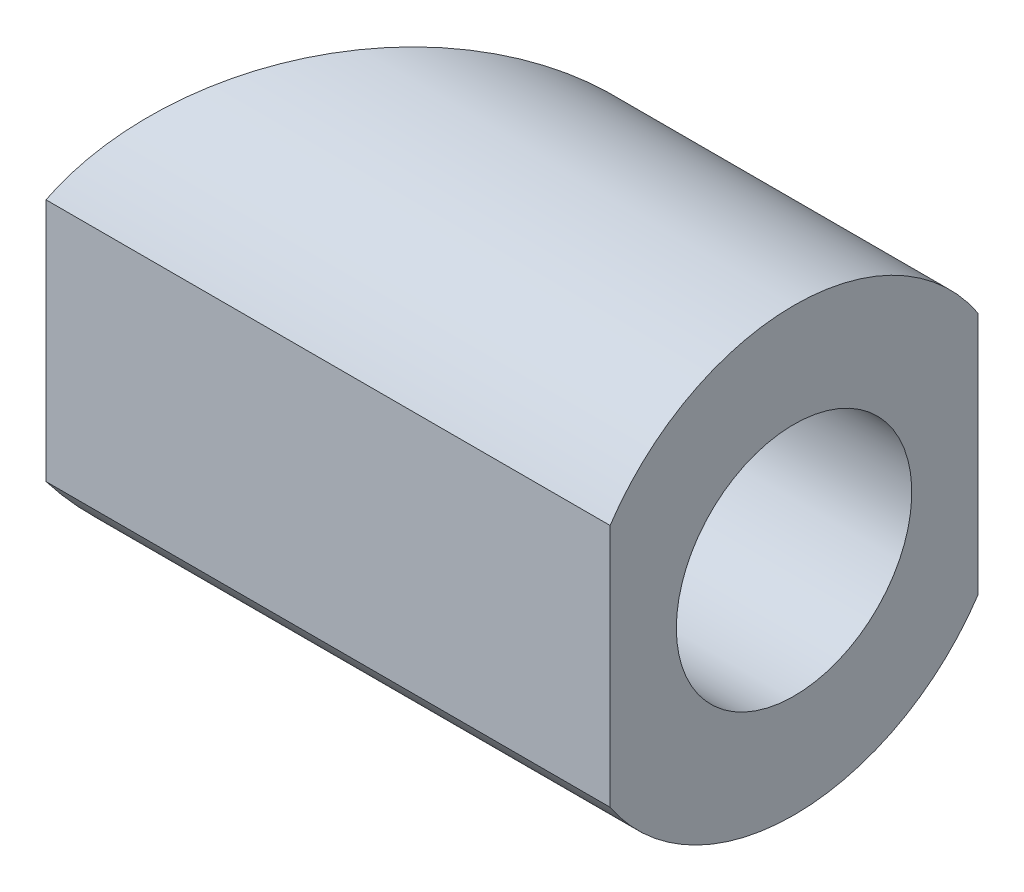
from build123d import *

# Parameters (mm, degrees)
CUT_EXTRUDE1_DEPTH      = 6.830951895
CUT_EXTRUDE1_DEPTH_BACK = 6.830951895
CUT_EXTRUDE2_DEPTH      = 6.830951895
CUT_EXTRUDE2_DEPTH_BACK = 6.830951895
SKETCH3_W               = 8
SKETCH3_H               = 0.5
SKETCH3_W_2             = 4.333333333


with BuildPart() as part:
    # Sketch1 → Revolve1 (revolve)
    with BuildSketch(Plane.XY, mode=Mode.PRIVATE) as revolve1_sk:
        Polygon((0, 0), (0, 1.6), (4, 1.6), (4, 3), (-4, 3), (-4, 0), align=None)
    revolve(revolve1_sk.sketch.rotate(Axis((0, 0, 0), (1, 0, 0)), 90), axis=Axis((0, 0, 0), (1, 0, 0)))

    # Sketch2 → Cut-Extrude1 (cut, two sides: drawn at the far end of the back side and taken through both)
    with BuildSketch(Plane(origin=(0, 0, 0), x_dir=(1, 0, 0), z_dir=(0, 1, 0)).offset(-CUT_EXTRUDE1_DEPTH_BACK)):
        Polygon((-4, -3), (0, 3), (-4, 3), align=None)
    extrude(amount=CUT_EXTRUDE1_DEPTH + CUT_EXTRUDE1_DEPTH_BACK, mode=Mode.SUBTRACT)

    # Sketch3 → Cut-Extrude2 (cut, two sides: drawn at the far end of the back side and taken through both)
    with BuildSketch(Plane(origin=(0, 0, 0), x_dir=(1, 0, 0), z_dir=(0, 1, 0)).offset(-CUT_EXTRUDE2_DEPTH_BACK)):
        with Locations((0, -2.75)):
            Rectangle(SKETCH3_W, SKETCH3_H)
        with Locations((1.833333333, 2.75)):
            Rectangle(SKETCH3_W_2, SKETCH3_H)
    extrude(amount=CUT_EXTRUDE2_DEPTH + CUT_EXTRUDE2_DEPTH_BACK, mode=Mode.SUBTRACT)


solid = part.part
